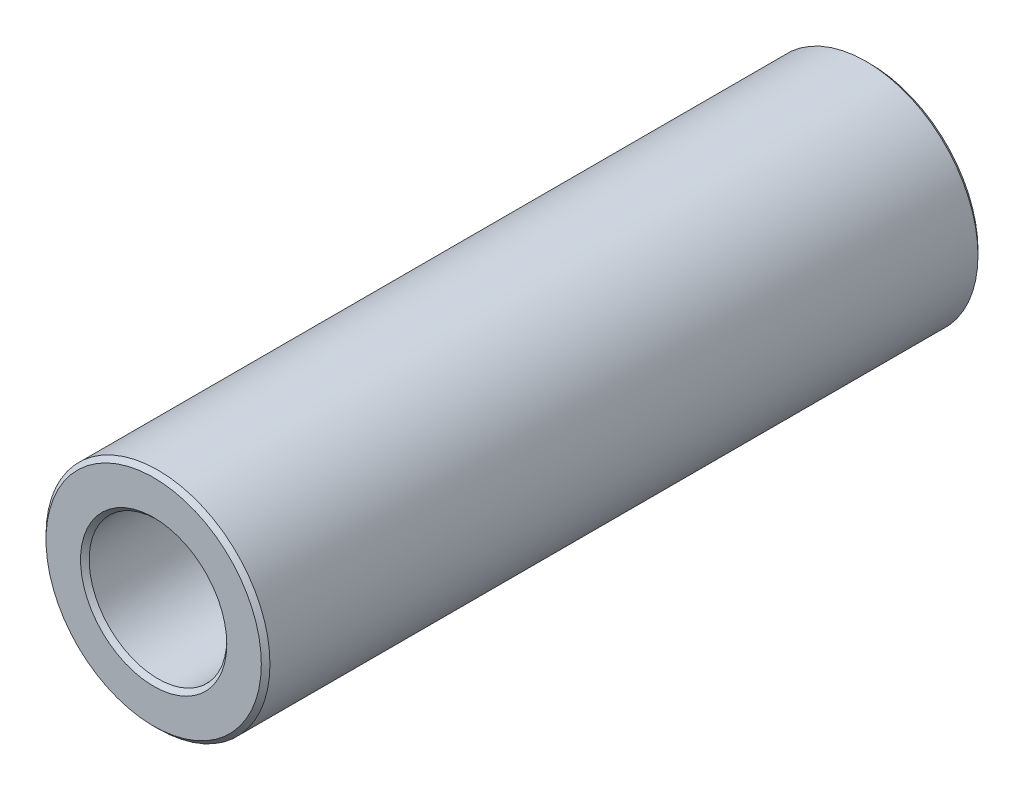
from build123d import *

# Parameters (mm, degrees)
BOSS_EXTRUDE1_DEPTH      = 12.7
BOSS_EXTRUDE1_DEPTH_BACK = 12.7
SKETCH3_R                = 3.96875
SKETCH3_R_2              = 2.4384
CHAMFER1_SIZE            = 0.153035


with BuildPart() as part:
    # Sketch3 → Boss-Extrude1 (new, two sides: drawn at the far end of the back side and taken through both)
    with BuildSketch(Plane.XY.offset(-BOSS_EXTRUDE1_DEPTH_BACK)):
        Circle(SKETCH3_R)
        Circle(SKETCH3_R_2, mode=Mode.SUBTRACT)
    extrude(amount=BOSS_EXTRUDE1_DEPTH + BOSS_EXTRUDE1_DEPTH_BACK)

    # Chamfer1
    chamfer1_edges = [part.edges().sort_by_distance(p)[0] for p in [
        (-3.96875, 0, -12.7),
        (-2.4384, 0, -12.7),
        (-3.96875, 0, 12.7),
        (-2.4384, 0, 12.7),
    ]]
    chamfer(chamfer1_edges, length=CHAMFER1_SIZE)


solid = part.part
